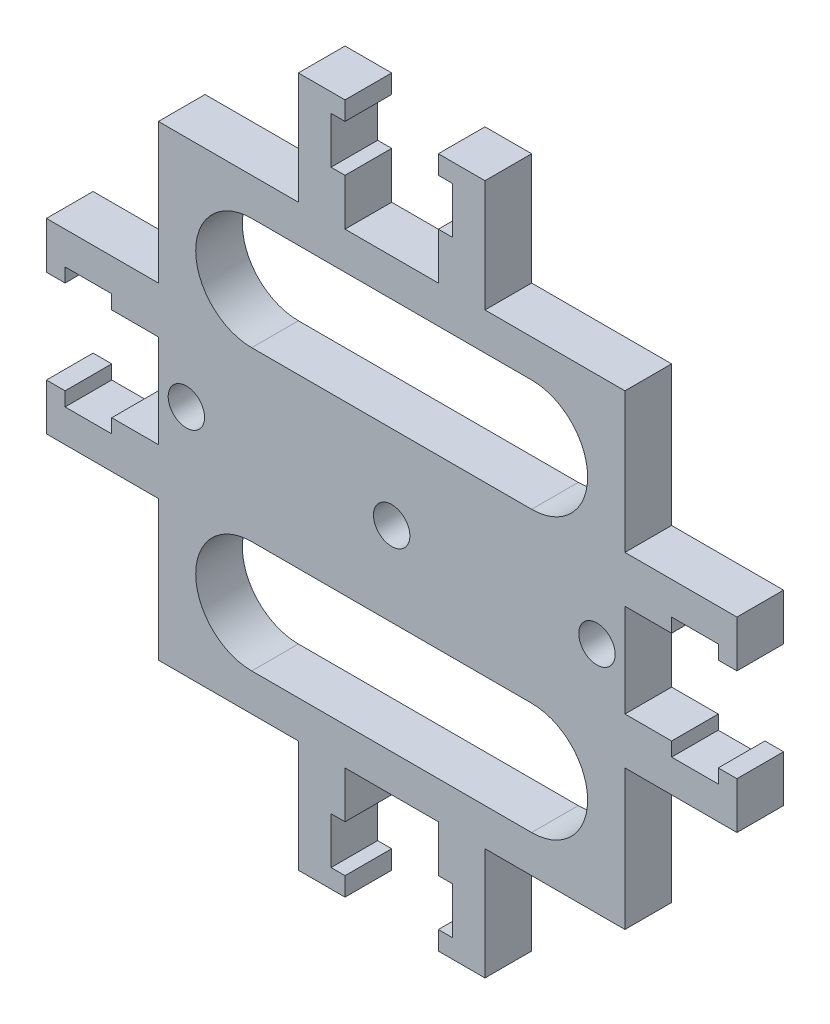
from build123d import *

# Parameters (mm, degrees)
ESQUISSE1_R        = 1.95
BOSS_EXTRU_1_DEPTH = 5


with BuildPart() as part:
    # Esquisse1 → Boss.-Extru.1 (new body)
    with BuildSketch(Plane.XY):
        Polygon((-10, 25), (-25, 25), (-25, 10), (-30, 10), (-37, 10), (-37, 5), (-35, 5), (-35, 6.5), (-30, 6.5), (-30, 5), (-25, 5), (-25, 0), (-25, -5), (-30, -5), (-30, -6.5), (-35, -6.5), (-35, -5), (-37, -5), (-37, -10), (-30, -10), (-25, -10), (-25, -25), (-10, -25), (-10, -30), (-10, -37), (-5, -37), (-5, -35), (-6.5, -35), (-6.5, -30), (-5, -30), (-5, -25), (0, -25), (5, -25), (5, -30), (6.5, -30), (6.5, -35), (5, -35), (5, -37), (10, -37), (10, -30), (10, -25), (25, -25), (25, -10), (30, -10), (37, -10), (37, -5), (35, -5), (35, -6.5), (30, -6.5), (30, -5), (25, -5), (25, 0), (25, 5), (30, 5), (30, 6.5), (35, 6.5), (35, 5), (37, 5), (37, 10), (30, 10), (25, 10), (25, 25), (10, 25), (10, 30), (10, 37), (5, 37), (5, 35), (6.5, 35), (6.5, 30), (5, 30), (5, 25), (0, 25), (-5, 25), (-5, 30), (-6.5, 30), (-6.5, 35), (-5, 35), (-5, 37), (-10, 37), (-10, 30), align=None)
        with Locations((-22, 0)):
            Circle(ESQUISSE1_R, mode=Mode.SUBTRACT)
        Circle(ESQUISSE1_R, mode=Mode.SUBTRACT)
        with BuildLine():
            Line((15, -21), (-15, -21))
            ThreePointArc((-15, -21), (-21, -15), (-15, -9))
            Line((-15, -9), (15, -9))
            ThreePointArc((15, -9), (21, -15), (15, -21))
        make_face(mode=Mode.SUBTRACT)
        with Locations((22, 0)):
            Circle(ESQUISSE1_R, mode=Mode.SUBTRACT)
        with BuildLine():
            ThreePointArc((-15, 9), (-21, 15), (-15, 21))
            Line((-15, 21), (15, 21))
            ThreePointArc((15, 21), (21, 15), (15, 9))
            Line((15, 9), (-15, 9))
        make_face(mode=Mode.SUBTRACT)
    extrude(amount=BOSS_EXTRU_1_DEPTH)


solid = part.part
